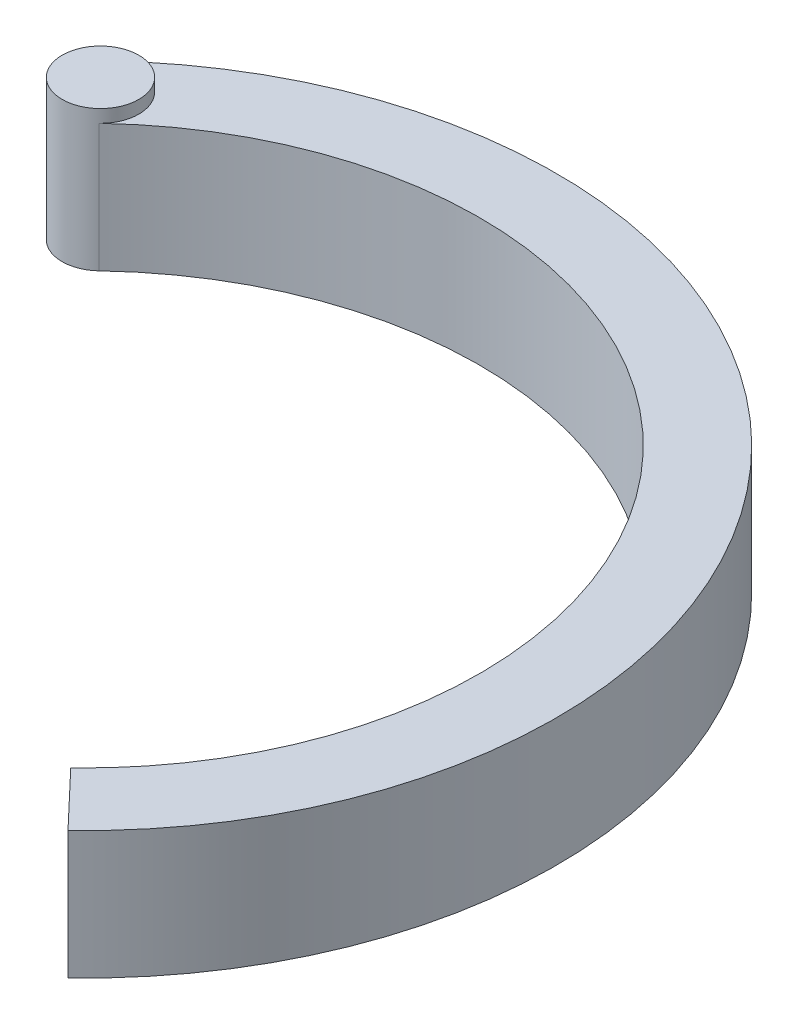
from build123d import *

# Parameters (mm, degrees)
BOSS_EXTRUDE8_DEPTH     = 10
SKETCH17_R              = 3
BOSS_EXTRUDE9_DEPTH     = 1
CUT_EXTRUDE3_DEPTH      = 48
CUT_EXTRUDE3_DEPTH_BACK = 52


with BuildPart() as part:
    # Sketch15 → Boss-Extrude8 (new body)
    with BuildSketch(Plane(origin=(0, 0, 0), x_dir=(1, 0, 0), z_dir=(0, 1, 0))):
        with BuildLine():
            ThreePointArc((48.775147877, -51.318855692), (50.100893899, 0.848781761), (-2.066743554, 2.174527784))
            ThreePointArc((-2.066743554, 2.174527784), (-2.174527784, -2.066743554), (2.066743554, -2.174527784))
            ThreePointArc((2.066743554, -2.174527784), (45.751838332, -3.284705347), (44.641660769, -46.969800125))
            ThreePointArc((44.641660769, -46.969800125), (44.533876539, -51.211071463), (48.775147877, -51.318855692))
        make_face()
    extrude(amount=BOSS_EXTRUDE8_DEPTH)

    # Sketch17 → Boss-Extrude9 (add)
    with BuildSketch(Plane(origin=(0, 10, 0), x_dir=(1, 0, 0), z_dir=(0, 1, 0))):
        with Locations(Location((0, 0, 0), (0, 0, 133.544244871))):
            Circle(SKETCH17_R)
    extrude(amount=BOSS_EXTRUDE9_DEPTH)

    # Sketch18 → Cut-Extrude3 (cut, two sides: drawn at the far end of the back side and taken through both)
    with BuildSketch(Plane(origin=(0, 10, 0), x_dir=(1, 0, 0), z_dir=(0, 1, 0)).offset(-CUT_EXTRUDE3_DEPTH_BACK)):
        with BuildLine():
            Line((44.641660769, -46.969800125), (48.775147877, -51.318855692))
            ThreePointArc((48.775147877, -51.318855692), (46.632189363, -52.143359632), (44.533876539, -51.211071463))
            ThreePointArc((44.533876539, -51.211071463), (43.709372599, -49.068112949), (44.641660769, -46.969800125))
        make_face()
    extrude(amount=CUT_EXTRUDE3_DEPTH + CUT_EXTRUDE3_DEPTH_BACK, mode=Mode.SUBTRACT)


solid = part.part
